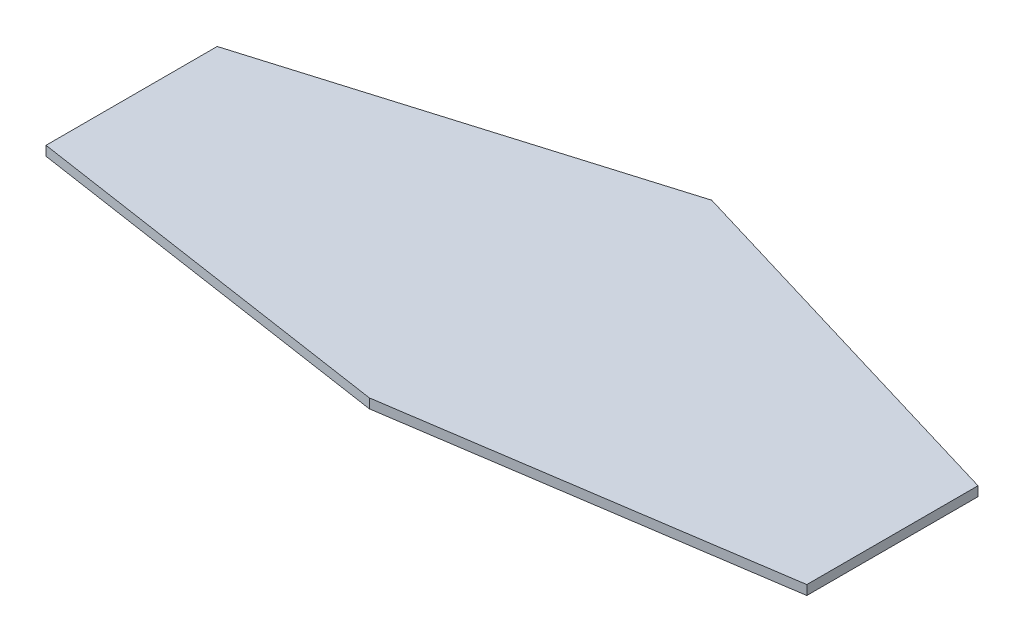
from build123d import *

# Parameters (mm, degrees)
EXTRUDE_1_DEPTH = 5


with BuildPart() as part:
    # 草图1 → 拉伸1 (new body)
    with BuildSketch(Plane(origin=(0, 0, 0), x_dir=(1, 0, 0), z_dir=(0, 1, 0))):
        Polygon((0, 120), (-200, 60), (-200, -30), (0, -60), (200, -30), (200, 60), align=None)
    extrude(amount=EXTRUDE_1_DEPTH)


solid = part.part
